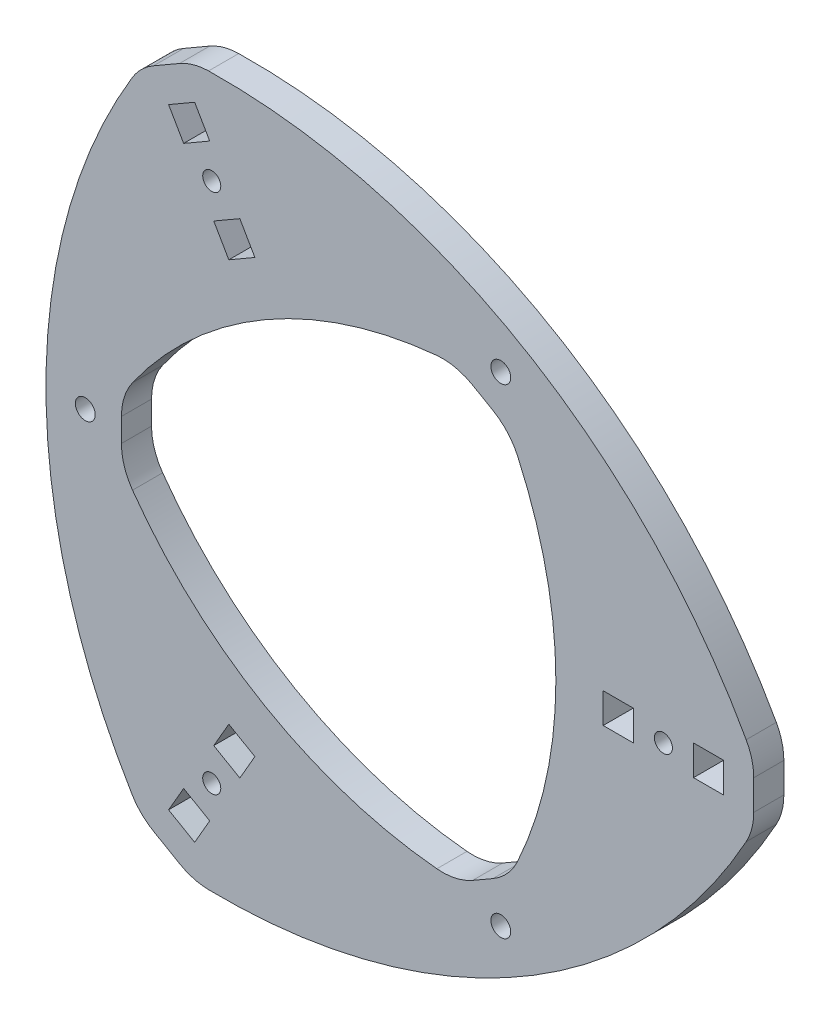
from build123d import *

# Parameters (mm, degrees)
ESQUISSE1_R        = 1.65
ESQUISSE1_R_2      = 1.5
ESQUISSE1_W        = 5
ESQUISSE1_H        = 5
BOSS_EXTRU_1_DEPTH = 5
FILLET1_R          = 10


with BuildPart() as part:
    # Esquisse1 → Boss.-Extru.1 (new body)
    with BuildSketch(Plane.XY):
        with BuildLine():
            Line((-36.830127019, 53.791651246), (-28.169872981, 58.791651246))
            ThreePointArc((-28.169872981, 58.791651246), (26.265157649, 45.492587517), (65, 5))
            Line((65, 5), (65, -5))
            ThreePointArc((65, -5), (26.265157649, -45.492587517), (-28.169872981, -58.791651246))
            Line((-28.169872981, -58.791651246), (-36.830127019, -53.791651246))
            ThreePointArc((-36.830127019, -53.791651246), (-52.530315298, 0), (-36.830127019, 53.791651246))
        make_face()
        with Locations((23, 39.837168574)):
            Circle(ESQUISSE1_R, mode=Mode.SUBTRACT)
        with Locations((23, -39.837168574)):
            Circle(ESQUISSE1_R, mode=Mode.SUBTRACT)
        with Locations((-46, 0)):
            Circle(ESQUISSE1_R, mode=Mode.SUBTRACT)
        with Locations((50, 0)):
            Circle(ESQUISSE1_R_2, mode=Mode.SUBTRACT)
        with Locations((-25, 43.301270189)):
            Circle(ESQUISSE1_R_2, mode=Mode.SUBTRACT)
        with Locations((-25, -43.301270189)):
            Circle(ESQUISSE1_R_2, mode=Mode.SUBTRACT)
        with BuildLine():
            Line((15.669872981, 37.141016151), (24.330127019, 32.141016151))
            ThreePointArc((24.330127019, 32.141016151), (32.145280949, 0), (24.330127019, -32.141016151))
            Line((24.330127019, -32.141016151), (15.669872981, -37.141016151))
            ThreePointArc((15.669872981, -37.141016151), (-16.072640474, -27.838629914), (-40, -5))
            Line((-40, -5), (-40, 5))
            ThreePointArc((-40, 5), (-16.072640474, 27.838629914), (15.669872981, 37.141016151))
        make_face(mode=Mode.SUBTRACT)
        with Locations((42.5, 0)):
            Rectangle(ESQUISSE1_W, ESQUISSE1_H, mode=Mode.SUBTRACT)
        with Locations((57.5, 0)):
            Rectangle(ESQUISSE1_W, ESQUISSE1_H, mode=Mode.SUBTRACT)
        Polygon((-25.334936491, 48.881397208), (-27.834936491, 53.211524227), (-32.165063509, 50.711524227), (-29.665063509, 46.381397208), align=None, mode=Mode.SUBTRACT)
        Polygon((-20.334936491, 40.22114317), (-17.834936491, 35.891016151), (-22.165063509, 33.391016151), (-24.665063509, 37.72114317), align=None, mode=Mode.SUBTRACT)
        Polygon((-29.665063509, -46.381397208), (-32.165063509, -50.711524227), (-27.834936491, -53.211524227), (-25.334936491, -48.881397208), align=None, mode=Mode.SUBTRACT)
        Polygon((-24.665063509, -37.72114317), (-22.165063509, -33.391016151), (-17.834936491, -35.891016151), (-20.334936491, -40.22114317), align=None, mode=Mode.SUBTRACT)
    extrude(amount=BOSS_EXTRU_1_DEPTH)

    # Fillet1
    fillet1_edges = [part.edges().sort_by_distance(p)[0] for p in [
        (-36.830127019, 53.791651246, 2.5),
        (-28.169872981, 58.791651246, 2.5),
        (65, 5, 2.5),
        (65, -5, 2.5),
        (-28.169872981, -58.791651246, 2.5),
        (-36.830127019, -53.791651246, 2.5),
        (15.669872981, 37.141016151, 2.5),
        (-40, 5, 2.5),
        (-40, -5, 2.5),
        (15.669872981, -37.141016151, 2.5),
        (24.330127019, -32.141016151, 2.5),
        (24.330127019, 32.141016151, 2.5),
    ]]
    fillet(fillet1_edges, radius=FILLET1_R)


solid = part.part
